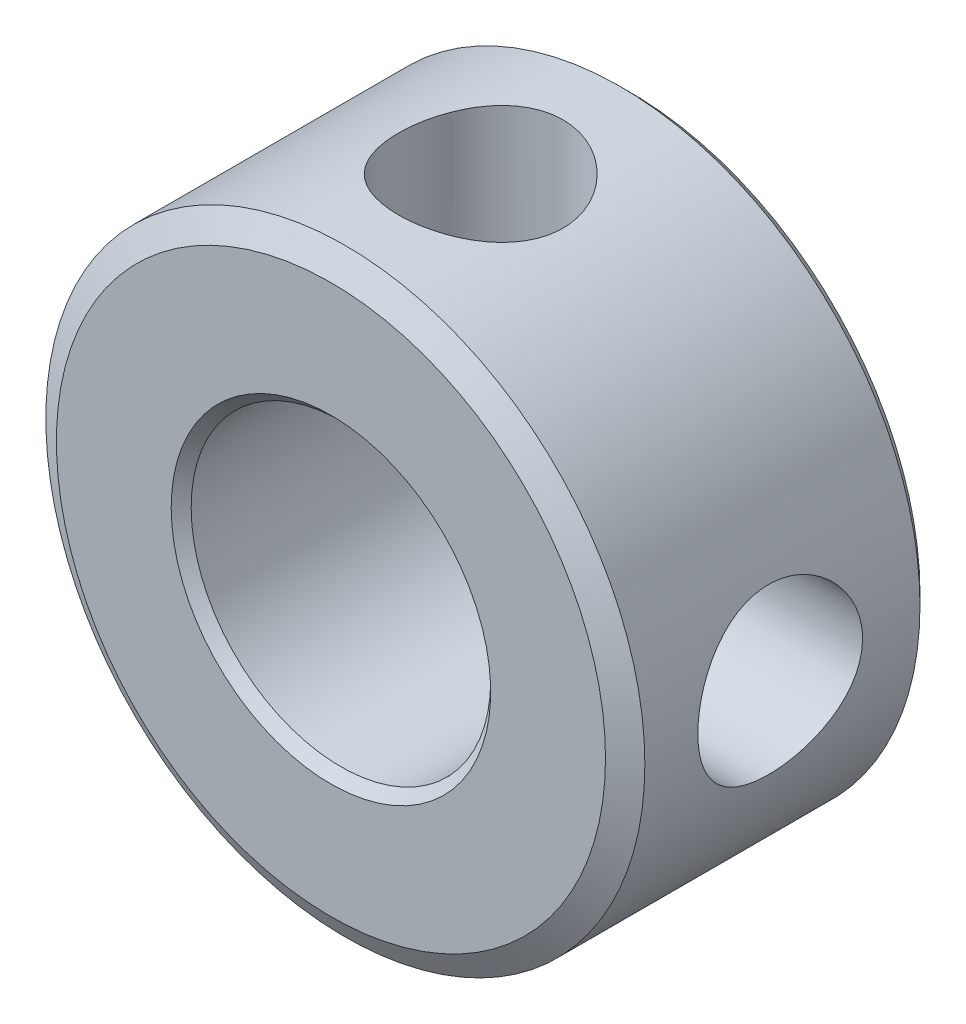
from build123d import *

# Parameters (mm, degrees)
SKETCH1_W           = 6
SKETCH1_H           = 3
TAPPED_HOLE1_REACH  = 16.697
TAPPED_HOLE1_BORE_R = 1.65
CIRPATTERN1_COUNT   = 2
CIRPATTERN1_ANGLE   = 90
CHAMFER1_SIZE       = 0.2


with BuildPart() as part:
    # Sketch1 → Revolve1 (revolve)
    with BuildSketch(Plane(origin=(0, 0, 0), x_dir=(0, 0, -1), z_dir=(1, 0, 0)), mode=Mode.PRIVATE) as revolve1_sk:
        with Locations((3, 4.5)):
            Rectangle(SKETCH1_W, SKETCH1_H)
    revolve(revolve1_sk.sketch.rotate(Axis((0, 0, 0), (0, 0, -1)), 90), axis=Axis((0, 0, 0), (0, 0, -1)))

    # Tapped Hole1 bore → Tapped Hole1 (cut, up to next)
    with BuildSketch(Plane(origin=(0, 6, 0), x_dir=(1, 0, 0), z_dir=(0, 1, 0)), mode=Mode.PRIVATE) as tapped_hole1_sk1:
        with Locations((0, 3)):
            Circle(TAPPED_HOLE1_BORE_R)
    tapped_hole1_tool1 = extrude(tapped_hole1_sk1.sketch, amount=-TAPPED_HOLE1_REACH, mode=Mode.PRIVATE) & part.part
    tapped_hole1 = tapped_hole1_tool1.solids().sort_by_distance((0, 6, -3))[0]
    add(tapped_hole1, mode=Mode.SUBTRACT)

    # CirPattern1: Tapped Hole1 ×2 about axis
    cirpattern1_axis = Axis((0, 0, 0), (0, 0, -1))
    for i in range(1, CIRPATTERN1_COUNT):
        add(tapped_hole1.rotate(cirpattern1_axis, i * CIRPATTERN1_ANGLE / (CIRPATTERN1_COUNT - 1)), mode=Mode.SUBTRACT)

    # Chamfer1
    chamfer1_edges = [part.edges().sort_by_distance(p)[0] for p in [
        (-3, 0, -6),
        (-3, 0, 0),
        (-6, 0, -6),
    ]]
    chamfer(chamfer1_edges, length=CHAMFER1_SIZE)

    # Sketch4 → Cut-Revolve1 (revolve, cut)
    with BuildSketch(Plane(origin=(0, 0, 0), x_dir=(0, 0, -1), z_dir=(1, 0, 0)), mode=Mode.PRIVATE) as cut_revolve1_sk:
        Polygon((0.288675135, 6), (0, 5.5), (0, 6), align=None)
    revolve(cut_revolve1_sk.sketch.rotate(Axis((0, 0, 0), (0, 0, -1)), 90), axis=Axis((0, 0, 0), (0, 0, -1)), mode=Mode.SUBTRACT)


solid = part.part
